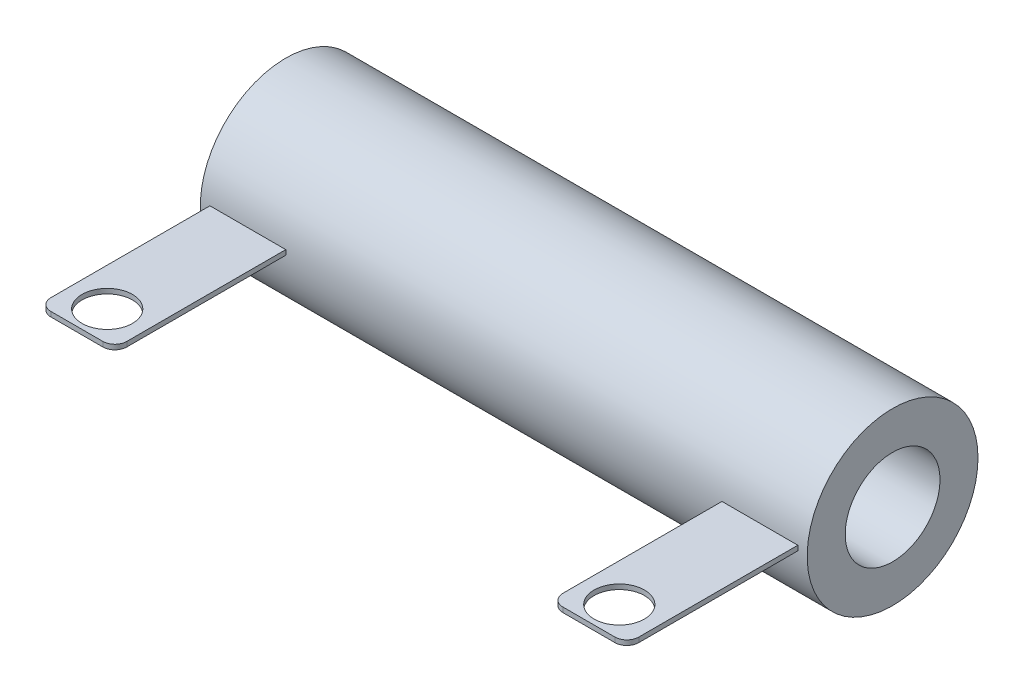
from build123d import *

# Parameters (mm, degrees)
SKETCH1_R             = 7.15
SKETCH1_R_2           = 3.97
BOSS_EXTRUDE1_DEPTH   = 25.4
SKETCH2_R             = 2.1085
BOSS_EXTRUDE2_DEPTH   = 0.407
BOSS_EXTRUDE2_2_DEPTH = 0.407


with BuildPart() as part:
    # Sketch1 → Boss-Extrude1 (new, symmetric)
    with BuildSketch(Plane(origin=(0, 0, 0), x_dir=(0, 0, -1), z_dir=(1, 0, 0))):
        Circle(SKETCH1_R)
        Circle(SKETCH1_R_2, mode=Mode.SUBTRACT)
    extrude(amount=BOSS_EXTRUDE1_DEPTH, both=True)


with BuildPart() as body_2:
    # Sketch2 → Boss-Extrude2 (new body)
    with BuildSketch(Plane(origin=(0, 0, 0), x_dir=(1, 0, 0), z_dir=(0, 1, 0))):
        with BuildLine():
            Line((-24.606, -5.19404127), (-18.256, -5.19404127))
            Line((-18.256, -5.19404127), (-18.256, -20.45))
            ThreePointArc((-18.256, -20.45), (-18.548893219, -21.157106781), (-19.256, -21.45))
            Line((-19.256, -21.45), (-23.606, -21.45))
            ThreePointArc((-23.606, -21.45), (-24.313106781, -21.157106781), (-24.606, -20.45))
            Line((-24.606, -20.45), (-24.606, -5.19404127))
        make_face()
        with Locations(Location((-21.431, -18.91, 0), (0, 0, 270))):
            Circle(SKETCH2_R, mode=Mode.SUBTRACT)
    extrude(amount=BOSS_EXTRUDE2_DEPTH)


with BuildPart() as body_3:
    # Sketch2 → Boss-Extrude2 2 (new body)
    with BuildSketch(Plane(origin=(0, 0, 0), x_dir=(1, 0, 0), z_dir=(0, 1, 0))):
        with BuildLine():
            Line((18.256, -5.19404127), (18.256, -20.45))
            ThreePointArc((18.256, -20.45), (18.548893219, -21.157106781), (19.256, -21.45))
            Line((19.256, -21.45), (23.606, -21.45))
            ThreePointArc((23.606, -21.45), (24.313106781, -21.157106781), (24.606, -20.45))
            Line((24.606, -20.45), (24.606, -5.19404127))
            Line((24.606, -5.19404127), (18.256, -5.19404127))
        make_face()
        with Locations(Location((21.431, -18.91, 0), (0, 0, 90))):
            Circle(SKETCH2_R, mode=Mode.SUBTRACT)
    extrude(amount=BOSS_EXTRUDE2_2_DEPTH)


solid = Compound([part.part, body_2.part, body_3.part])
